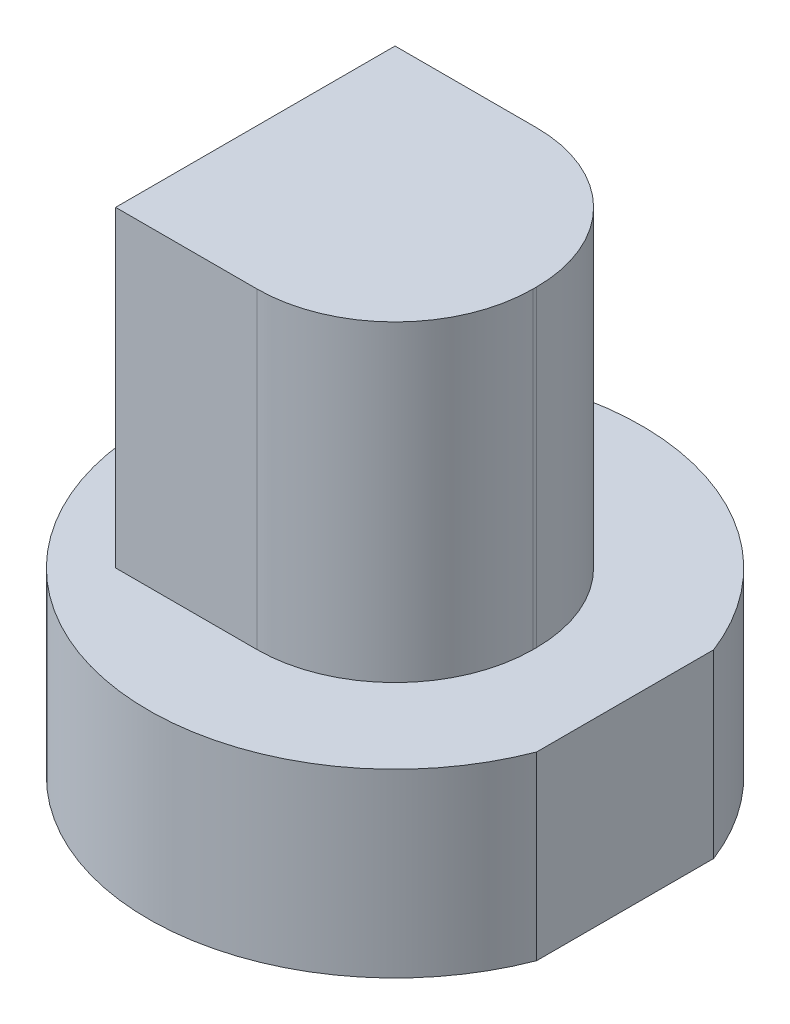
from build123d import *

# Parameters (mm, degrees)
SALIENTE_EXTRUIR1_DEPTH = 5.5
SALIENTE_EXTRUIR2_DEPTH = 9.5
CROQUIS3_R              = 3.75
CORTAR_EXTRUIR1_DEPTH   = 1.2
CROQUIS5_R              = 2.75
CORTAR_EXTRUIR3_DEPTH   = 13


with BuildPart() as part:
    # Croquis1 → Saliente-Extruir1 (new body)
    with BuildSketch(Plane(origin=(0, 0, 0), x_dir=(1, 0, 0), z_dir=(0, 1, 0))):
        with BuildLine():
            Line((7, 2.692582404), (7, -2.692582404))
            ThreePointArc((7, -2.692582404), (-7.5, 0), (7, 2.692582404))
        make_face()
    extrude(amount=SALIENTE_EXTRUIR1_DEPTH)

    # Croquis2 → Saliente-Extruir2 (add)
    with BuildSketch(Plane(origin=(0, 5.5, 0), x_dir=(1, 0, 0), z_dir=(0, 1, 0))):
        with BuildLine():
            Line((-4.25, -4.25), (0.05, -4.25))
            ThreePointArc((0.05, -4.25), (3.019848481, -3.019848481), (4.25, -0.05))
            Line((4.25, -0.05), (4.25, 0.05))
            ThreePointArc((4.25, 0.05), (3.019848481, 3.019848481), (0.05, 4.25))
            Line((0.05, 4.25), (-4.25, 4.25))
            Line((-4.25, 4.25), (-4.25, -4.25))
        make_face()
    extrude(amount=SALIENTE_EXTRUIR2_DEPTH)

    # Croquis3 → Cortar-Extruir1 (cut)
    with BuildSketch(Plane.XZ):
        with Locations(Location((0, 0, 0), (0, 0, 270))):
            Circle(CROQUIS3_R)
    extrude(amount=-CORTAR_EXTRUIR1_DEPTH, mode=Mode.SUBTRACT)

    # Croquis5 → Cortar-Extruir3 (cut)
    with BuildSketch(Plane.XZ.offset(-1.2)):
        with Locations(Location((0, 0, 0), (0, 0, 270))):
            Circle(CROQUIS5_R)
    extrude(amount=-CORTAR_EXTRUIR3_DEPTH, mode=Mode.SUBTRACT)


solid = part.part
